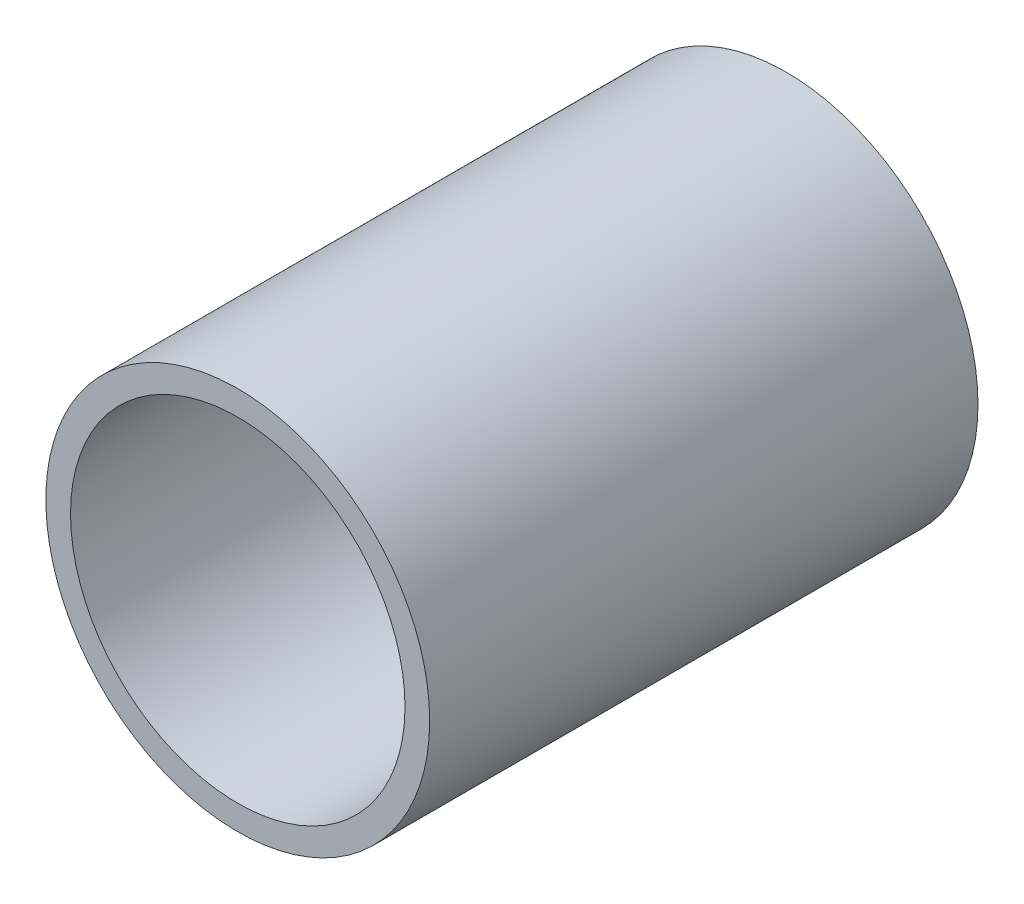
from build123d import *

# Parameters (mm, degrees)
BOSS_EXTRUDE1_DEPTH      = 5
BOSS_EXTRUDE1_DEPTH_BACK = 5
SKETCH3_R                = 3.5
SKETCH3_R_2              = 3.05


with BuildPart() as part:
    # Sketch3 → Boss-Extrude1 (new, two sides: drawn at the far end of the back side and taken through both)
    with BuildSketch(Plane.XY.offset(-BOSS_EXTRUDE1_DEPTH_BACK)):
        Circle(SKETCH3_R)
        Circle(SKETCH3_R_2, mode=Mode.SUBTRACT)
    extrude(amount=BOSS_EXTRUDE1_DEPTH + BOSS_EXTRUDE1_DEPTH_BACK)


solid = part.part
